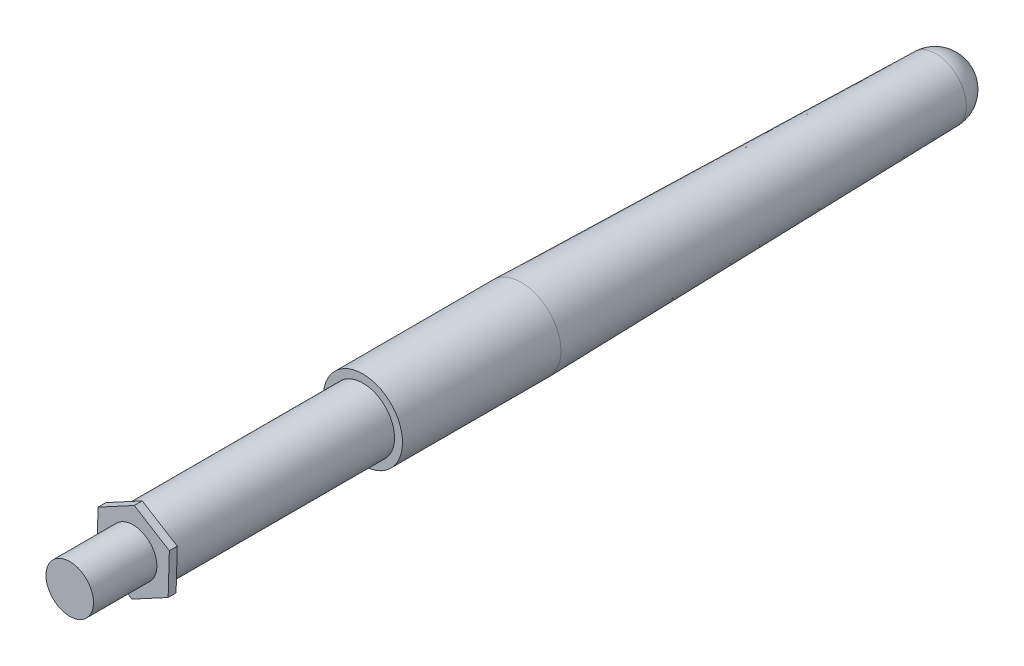
from build123d import *

# Parameters (mm, degrees)
CROQUIS1_R              = 3
SALIENTE_EXTRUIR1_DEPTH = 8
SALIENTE_EXTRUIR2_DEPTH = 1
CROQUIS3_R              = 4
SALIENTE_EXTRUIR3_DEPTH = 33
SALIENTE_EXTRUIR5_START = -5
CROQUIS6_R              = 5
SALIENTE_EXTRUIR5_DEPTH = 20
CROQUIS7_R              = 3.75
REDONDEO3_R             = 3.75


with BuildPart() as part:
    # Croquis1 → Saliente-Extruir1 (new body)
    with BuildSketch(Plane.XY):
        Circle(CROQUIS1_R)
    extrude(amount=SALIENTE_EXTRUIR1_DEPTH)

    # Croquis2 → Saliente-Extruir2 (add)
    with BuildSketch(Plane(origin=(0, 0, 0), x_dir=(-1, 0, 0), z_dir=(0, 0, -1))):
        Polygon((4.42226819, 2.728285919), (-0.151630819, 5.193939554), (-4.573899009, 2.465653636), (-4.42226819, -2.728285919), (0.151630819, -5.193939554), (4.573899009, -2.465653636), align=None)
    extrude(amount=SALIENTE_EXTRUIR2_DEPTH)

    # Croquis3 → Saliente-Extruir3 (add)
    with BuildSketch(Plane(origin=(0, 0, -1), x_dir=(-1, 0, 0), z_dir=(0, 0, -1))):
        Circle(CROQUIS3_R)
    extrude(amount=SALIENTE_EXTRUIR3_DEPTH)

    # Croquis6 → Saliente-Extruir5 (add)
    with BuildSketch(Plane(origin=(0, 0, -34), x_dir=(-1, 0, 0), z_dir=(0, 0, -1)).offset(SALIENTE_EXTRUIR5_START)):
        Circle(CROQUIS6_R)
    extrude(amount=SALIENTE_EXTRUIR5_DEPTH)

    # Croquis7 → section 1 of recubrir2
    with BuildSketch(Plane(origin=(0, 0, -105), x_dir=(-1, 0, 0), z_dir=(0, 0, -1)), mode=Mode.PRIVATE) as recubrir2_s1:
        Circle(CROQUIS7_R)
    # loft up to a face of the part (recubrir2)
    loft([Face(Wire([part.edges().sort_by_distance((3.42273553, 3.644843137, -49))[0]])), recubrir2_s1.sketch])

    # Redondeo3
    redondeo3_edges = [part.edges().sort_by_distance(p)[0] for p in [
        (3.75, 0, -105),
    ]]
    fillet(redondeo3_edges, radius=REDONDEO3_R)


solid = part.part
